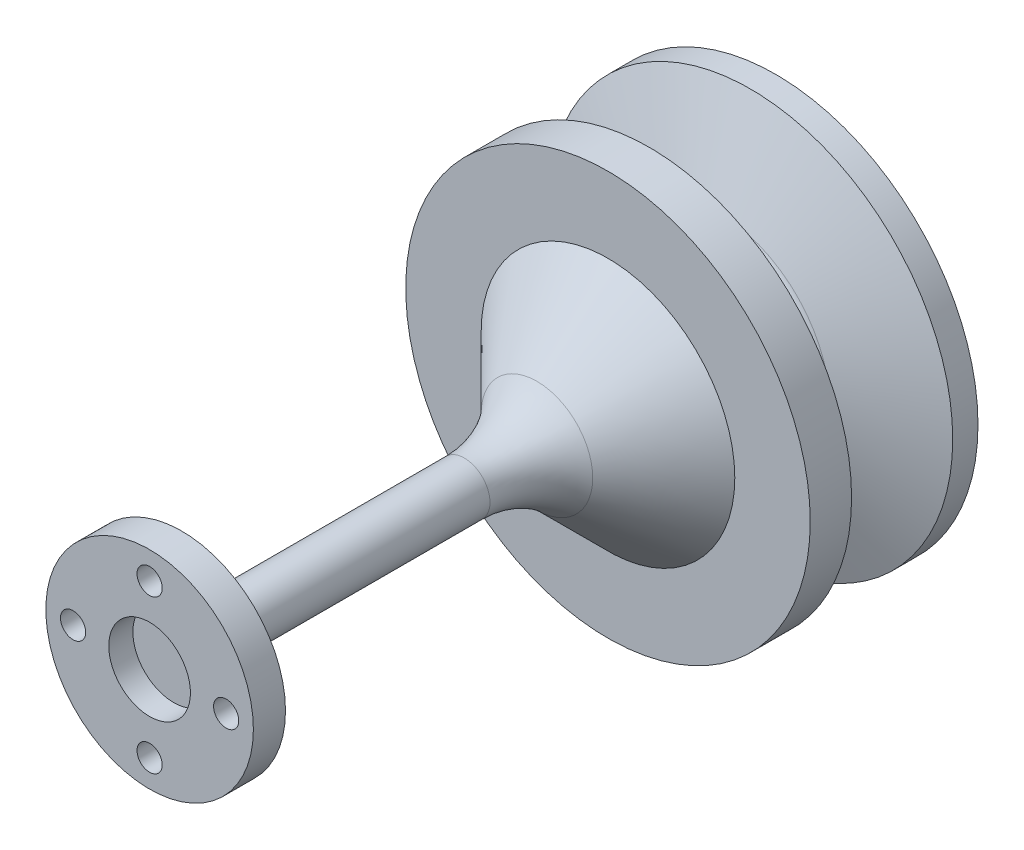
from build123d import *

# Parameters (mm, degrees)
ESQUISSE1_R                  = 20
BOSS_EXTRU_1_DEPTH           = 7.5
CONG_1_R                     = 1.7
CONG_3_R                     = 1.7
ESQUISSE5_R                  = 5
ENL_V_MAT_EXTRU_1_DEPTH      = 33.015621312
ESQUISSE8_R                  = 2.54
BOSS_EXTRU_3_DEPTH           = 43.7388
BOSS_EXTRU_4_START           = 1.5875
ESQUISSE9_R                  = 20
BOSS_EXTRU_4_DEPTH           = 1.5875
ESQUISSE10_R                 = 10.2616
BOSS_EXTRU_5_DEPTH           = 3.175
ENL_V_MAT_EXTRU_3_REACH      = 70.068
ESQUISSE11_R                 = 1.2446
R_P_TITION_CIRCULAIRE2_COUNT = 4
ESQUISSE12_R                 = 4.0386
ENL_V_MAT_EXTRU_4_DEPTH      = 2.38125
CHAMFER1_SIZE                = 10
FILLET1_R                    = 10.16


with BuildPart() as part:
    # Esquisse1 → Boss.-Extru.1 (new, symmetric)
    with BuildSketch(Plane.XY):
        Circle(ESQUISSE1_R)
    extrude(amount=BOSS_EXTRU_1_DEPTH, both=True)

    # Esquisse4 → Enlèvement de matière-Révolution1 (revolve, cut)
    with BuildSketch(Plane(origin=(0, 0, 0), x_dir=(0, 0, -1), z_dir=(1, 0, 0)), mode=Mode.PRIVATE) as enl_vement_de_mati_re_r_volution1_sk:
        Polygon((-5, 20), (-1.324936438, 10), (1.324936438, 10), (5, 20), align=None)
    revolve(enl_vement_de_mati_re_r_volution1_sk.sketch.rotate(Axis((0, 0, 15.788572615), (0, 0, -1)), 90), axis=Axis((0, 0, 15.788572615), (0, 0, -1)), mode=Mode.SUBTRACT)

    # Congé1
    cong_1_edges = [part.edges().sort_by_distance(p)[0] for p in [
        (-10, 0, -1.324936438),
    ]]
    fillet(cong_1_edges, radius=CONG_1_R)

    # Congé3
    cong_3_edges = [part.edges().sort_by_distance(p)[0] for p in [
        (-10, 0, 1.324936438),
    ]]
    fillet(cong_3_edges, radius=CONG_3_R)

    # Esquisse5 → Enlèv. mat.-Extru.1 (cut, through all)
    with BuildSketch(Plane.XY.offset(7.5)):
        Circle(ESQUISSE5_R)
    extrude(amount=-ENL_V_MAT_EXTRU_1_DEPTH, mode=Mode.SUBTRACT)



with BuildPart() as body_2:
    # Esquisse8 → Boss.-Extru.3 (new body)
    with BuildSketch(Plane.XY.offset(7.5)):
        Circle(ESQUISSE8_R)
    extrude(amount=BOSS_EXTRU_3_DEPTH)


with BuildPart() as part_1:
    add(part.part)

    add(body_2.part)  # Boss.-Extru.4 merges body 2
    # Esquisse9 → Boss.-Extru.4 (add)
    with BuildSketch(Plane.XY.offset(7.5).offset(BOSS_EXTRU_4_START)):
        Circle(ESQUISSE9_R)
    extrude(amount=-BOSS_EXTRU_4_DEPTH)

    # Esquisse10 → Boss.-Extru.5 (add)
    with BuildSketch(Plane.XY.offset(51.2388)):
        Circle(ESQUISSE10_R)
    extrude(amount=BOSS_EXTRU_5_DEPTH)

    # Esquisse11 → Enlèv. mat.-Extru.3 (cut, up to next)
    with BuildSketch(Plane.XY.offset(54.4138), mode=Mode.PRIVATE) as enl_v_mat_extru_3_sk1:
        with Locations((0, 7.5692)):
            Circle(ESQUISSE11_R)
    enl_v_mat_extru_3_tool1 = extrude(enl_v_mat_extru_3_sk1.sketch, amount=-ENL_V_MAT_EXTRU_3_REACH, mode=Mode.PRIVATE) & part_1.part
    enl_v_mat_extru_3 = enl_v_mat_extru_3_tool1.solids().sort_by_distance((0, 7.5692, 54.4138))[0]
    add(enl_v_mat_extru_3, mode=Mode.SUBTRACT)

    # Répétition circulaire2: Enlèv. mat.-Extru.3 ×4 about axis
    r_p_tition_circulaire2_axis = Axis((0, 0, 0), (0, 0, 1))
    for i in range(1, R_P_TITION_CIRCULAIRE2_COUNT):
        add(enl_v_mat_extru_3.rotate(r_p_tition_circulaire2_axis, i * 360 / R_P_TITION_CIRCULAIRE2_COUNT), mode=Mode.SUBTRACT)

    # Esquisse12 → Enlèv. mat.-Extru.4 (cut)
    with BuildSketch(Plane.XY.offset(54.4138)):
        Circle(ESQUISSE12_R)
    extrude(amount=-ENL_V_MAT_EXTRU_4_DEPTH, mode=Mode.SUBTRACT)

    # Chamfer1
    chamfer1_edges = [part_1.edges().sort_by_distance(p)[0] for p in [
        (-2.54, 0, 9.0875),
    ]]
    chamfer(chamfer1_edges, length=CHAMFER1_SIZE)

    # Fillet1
    fillet1_edges = [part_1.edges().sort_by_distance(p)[0] for p in [
        (-2.54, 0, 19.0875),
    ]]
    fillet(fillet1_edges, radius=FILLET1_R)


solid = part_1.part
